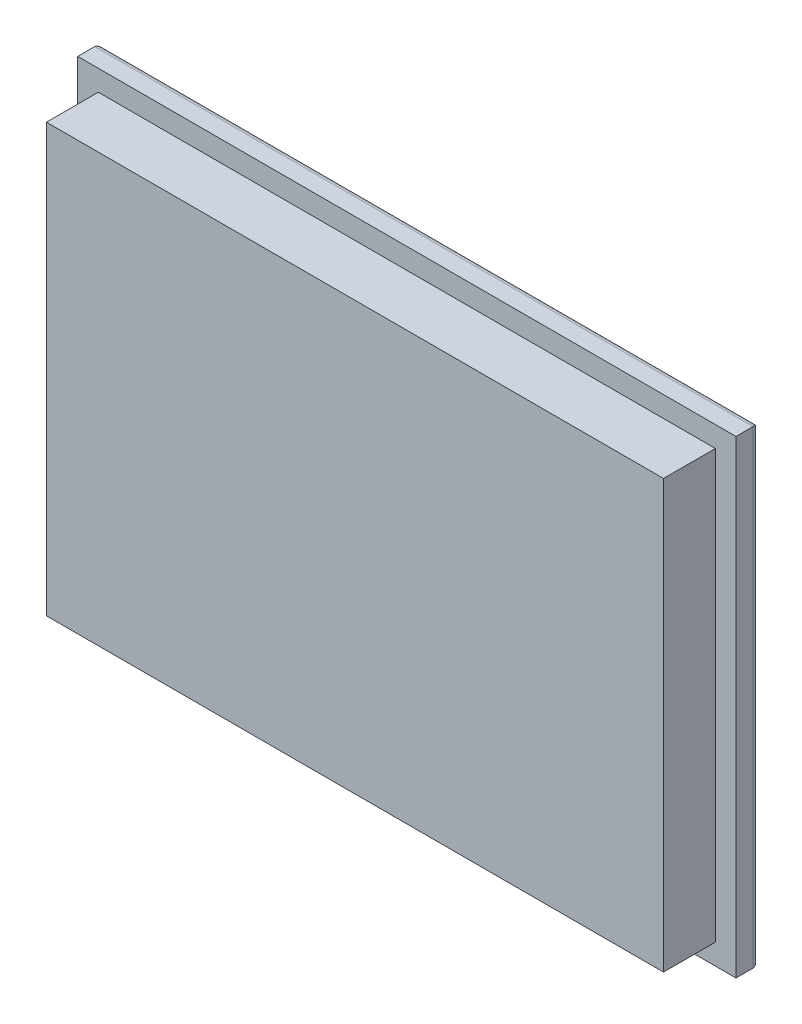
from build123d import *

# Parameters (mm, degrees)
SKETCH_1_W          = 209.4
SKETCH_1_H          = 149.2
EXTRUDE_1_DEPTH     = 7.4
SKETCH_2_W          = 196.3
SKETCH_2_H          = 136
EXTRUDE_2_DEPTH     = 16.5
SKETCH_4_W          = 154.1
SKETCH_4_H          = 85.9
CUT_EXTRUDE_1_DEPTH = 1.5
FILLET_1_R          = 2
SKETCH_5_W          = 199.4
SKETCH_5_H          = 139.2
CUT_EXTRUDE_2_DEPTH = 0.5
FILLET_2_R          = 3


with BuildPart() as part:
    # 草图1 → 凸台-拉伸1 (new body)
    with BuildSketch(Plane.XY):
        Rectangle(SKETCH_1_W, SKETCH_1_H)
    extrude(amount=EXTRUDE_1_DEPTH)

    # 草图2 → 凸台-拉伸2 (add)
    with BuildSketch(Plane.XY.offset(7.4)):
        Rectangle(SKETCH_2_W, SKETCH_2_H)
    extrude(amount=EXTRUDE_2_DEPTH)

    # 草图4 → 切除-拉伸1 (cut)
    with BuildSketch(Plane(origin=(0, 0, 0), x_dir=(-1, 0, 0), z_dir=(0, 0, -1))):
        with Locations((-1.2, 6.2)):
            Rectangle(SKETCH_4_W, SKETCH_4_H)
    extrude(amount=-CUT_EXTRUDE_1_DEPTH, mode=Mode.SUBTRACT)

    # 圆角1
    fillet_1_edges = [part.edges().sort_by_distance(p)[0] for p in [
        (0, 74.6, 0),
        (104.7, 0, 0),
        (0, -74.6, 0),
        (-104.7, 0, 0),
    ]]
    fillet(fillet_1_edges, radius=FILLET_1_R)

    # 草图5 → 切除-拉伸2 (cut)
    with BuildSketch(Plane(origin=(0, 0, 0), x_dir=(-1, 0, 0), z_dir=(0, 0, -1))):
        Rectangle(SKETCH_5_W, SKETCH_5_H)
    extrude(amount=-CUT_EXTRUDE_2_DEPTH, mode=Mode.SUBTRACT)

    # 圆角2
    fillet_2_edges = [part.edges().sort_by_distance(p)[0] for p in [
        (99.7, -69.6, 0.25),
        (99.7, 69.6, 0.25),
        (-99.7, 69.6, 0.25),
        (-99.7, -69.6, 0.25),
    ]]
    fillet(fillet_2_edges, radius=FILLET_2_R)


solid = part.part
